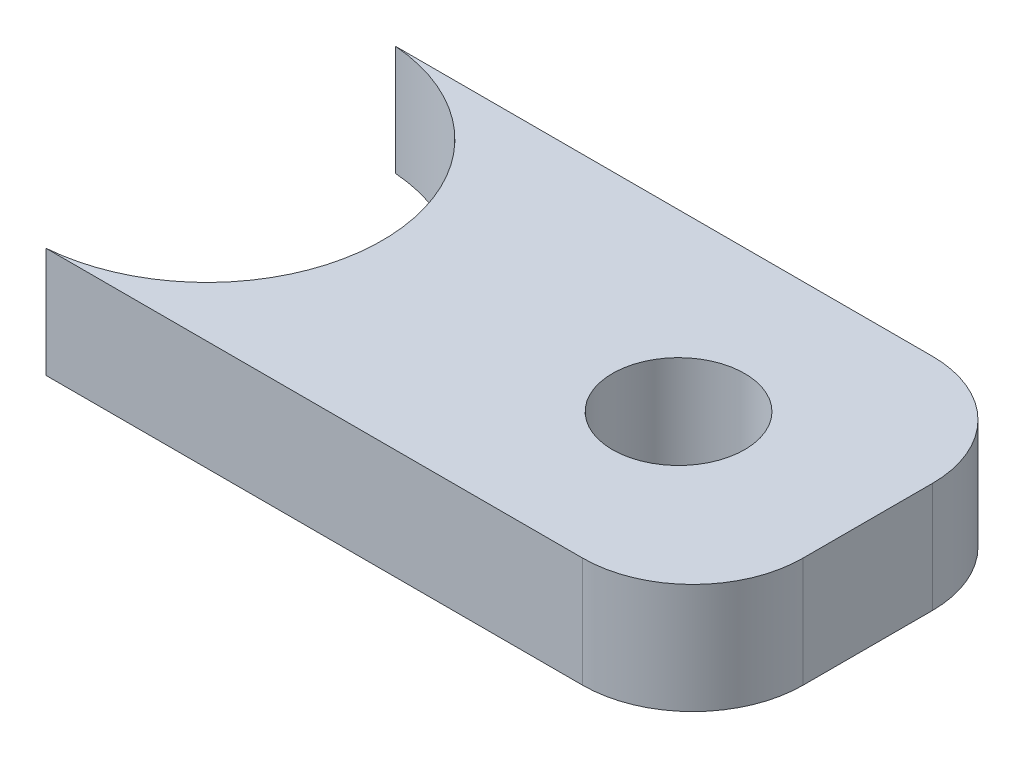
from build123d import *

# Parameters (mm, degrees)
SKETCH1_R           = 0.2362205
BOSS_EXTRUDE1_DEPTH = 0.393701


with BuildPart() as part:
    # Sketch1 → Boss-Extrude1 (new body)
    with BuildSketch(Plane(origin=(0, 0, 0), x_dir=(1, 0, 0), z_dir=(0, 1, 0))):
        with BuildLine():
            Line((0.787399, 0.625), (-1.131091774, 0.625))
            ThreePointArc((-1.131091774, 0.625), (-0.72040441, 0.425306238), (-0.554102534, 0))
            ThreePointArc((-0.554102534, 0), (-0.72040441, -0.425306238), (-1.131091774, -0.625))
            Line((-1.131091774, -0.625), (0.787399, -0.625))
            ThreePointArc((0.787399, -0.625), (1.065787647, -0.509687647), (1.1811, -0.231299))
            Line((1.1811, -0.231299), (1.1811, 0.231299))
            ThreePointArc((1.1811, 0.231299), (1.065787647, 0.509687647), (0.787399, 0.625))
        make_face()
        with Locations(Location((0.505047652, 0, 0), (0, 0, 270))):
            Circle(SKETCH1_R, mode=Mode.SUBTRACT)
    extrude(amount=BOSS_EXTRUDE1_DEPTH)


solid = part.part
